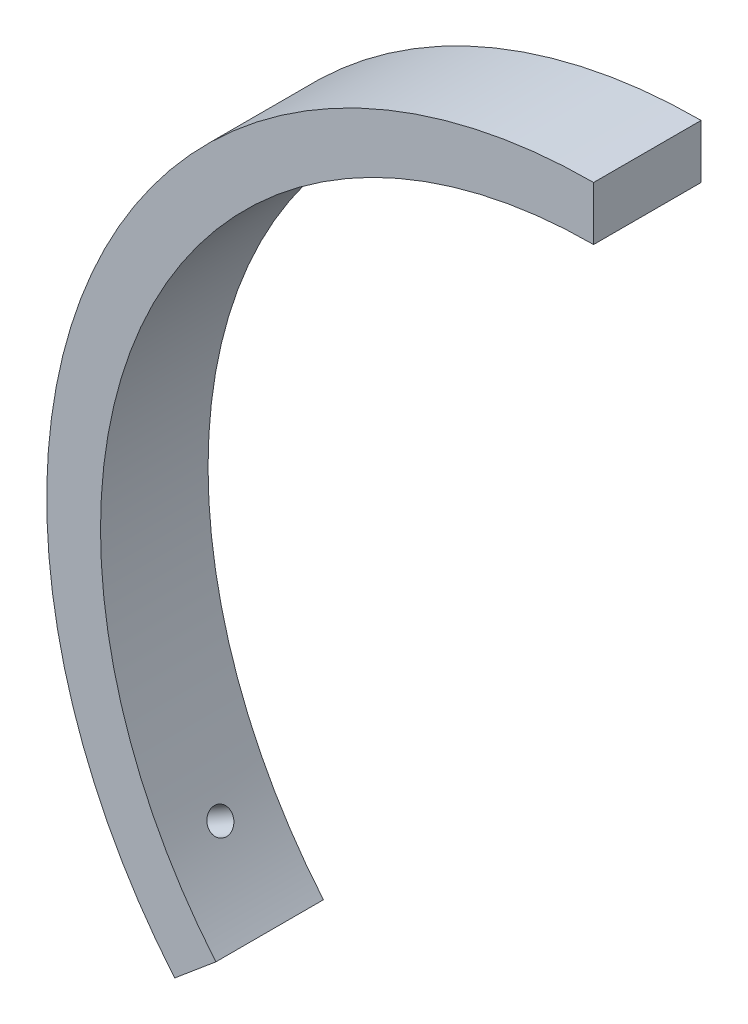
from build123d import *

# Parameters (mm, degrees)
ESTRUSIONE_ESTRUSIONE1_DEPTH           = 20
FORO_SVASATO_PER_VITE_M4_1_D           = 4.5
FORO_SVASATO_PER_VITE_M4_1_DEPTH       = 30
FORO_SVASATO_PER_VITE_M4_1_CSINK_D     = 9.4
FORO_SVASATO_PER_VITE_M4_1_CSINK_ANGLE = 90
FORO_SVASATO_PER_VITE_M4_1_TIP         = 1.351936393


with BuildPart() as part:
    # Schizzo1 → Estrusione-Estrusione1 (new body)
    with BuildSketch(Plane.XY):
        with BuildLine():
            Line((-88.074783565, -50.85), (-79.414529527, -45.85))
            ThreePointArc((-79.414529527, -45.85), (-79.414529527, 45.85), (0, 91.7))
            Line((0, 91.7), (0, 101.7))
            ThreePointArc((0, 101.7), (-88.074783565, 50.85), (-88.074783565, -50.85))
        make_face()
        with BuildLine():
            Line((-77.906719865, -65.371499905), (-70.246275434, -58.943623808))
            ThreePointArc((-70.246275434, -58.943623808), (-75.116242461, -52.596959213), (-79.414529527, -45.85))
            Line((-79.414529527, -45.85), (-88.074783565, -50.85))
            ThreePointArc((-88.074783565, -50.85), (-83.307762904, -58.332723577), (-77.906719865, -65.371499905))
        make_face()
    extrude(amount=ESTRUSIONE_ESTRUSIONE1_DEPTH)

    # Foro svasato per Vite M4-1
    with Locations(Plane(origin=(-88.074783565, -50.85, 10), x_dir=(0.5, -0.866025403784, 0), z_dir=(-0.866025403784, -0.5, 0))):
        with Locations((0, 0)):
            CounterSinkHole(FORO_SVASATO_PER_VITE_M4_1_D / 2, FORO_SVASATO_PER_VITE_M4_1_CSINK_D / 2, depth=FORO_SVASATO_PER_VITE_M4_1_DEPTH, counter_sink_angle=FORO_SVASATO_PER_VITE_M4_1_CSINK_ANGLE)
            with Locations((0, 0, -(FORO_SVASATO_PER_VITE_M4_1_DEPTH + FORO_SVASATO_PER_VITE_M4_1_TIP / 2))):  # 118° drill point
                Cone(0, FORO_SVASATO_PER_VITE_M4_1_D / 2, FORO_SVASATO_PER_VITE_M4_1_TIP, mode=Mode.SUBTRACT)


solid = part.part
